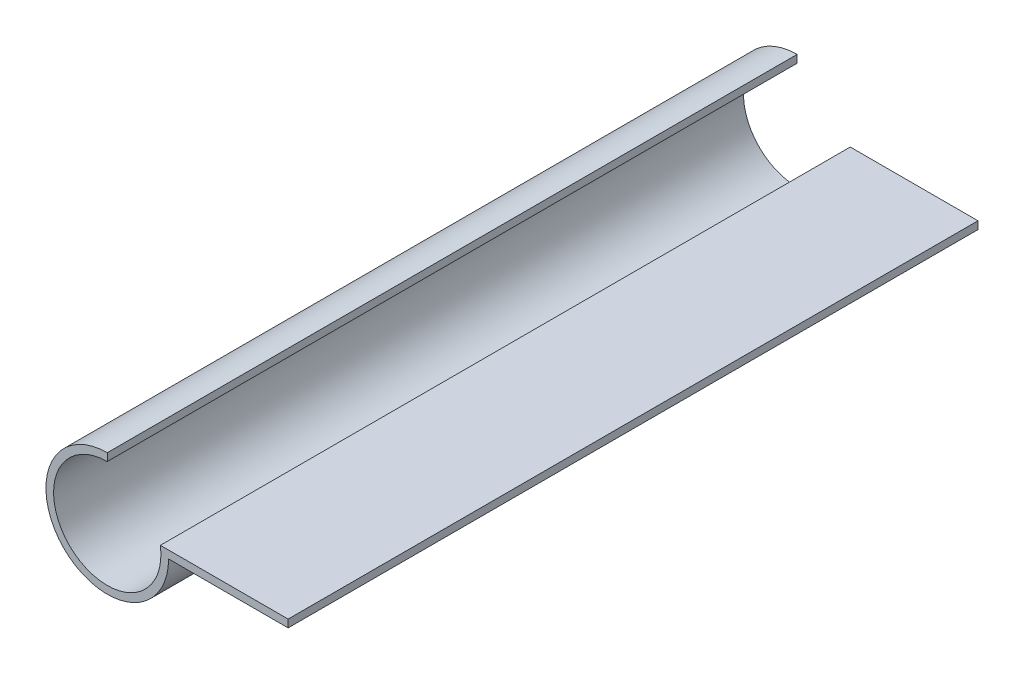
from build123d import *

# Parameters (mm, degrees)
BOSS_EXTRUDE1_DEPTH = 27


with BuildPart() as part:
    # Sketch1 → Boss-Extrude1 (new body)
    with BuildSketch(Plane.XY):
        with BuildLine():
            Line((7.078460969, 0), (2.4, 0))
            ThreePointArc((2.4, 0), (-1.697056275, -1.697056275), (0, 2.4))
            Line((0, 2.4), (0, 2.1))
            ThreePointArc((0, 2.1), (-1.374772708, -1.587450787), (2.078460969, 0.3))
            Line((2.078460969, 0.3), (7.078460969, 0.3))
            Line((7.078460969, 0.3), (7.078460969, 0))
        make_face()
    extrude(amount=BOSS_EXTRUDE1_DEPTH)


solid = part.part
